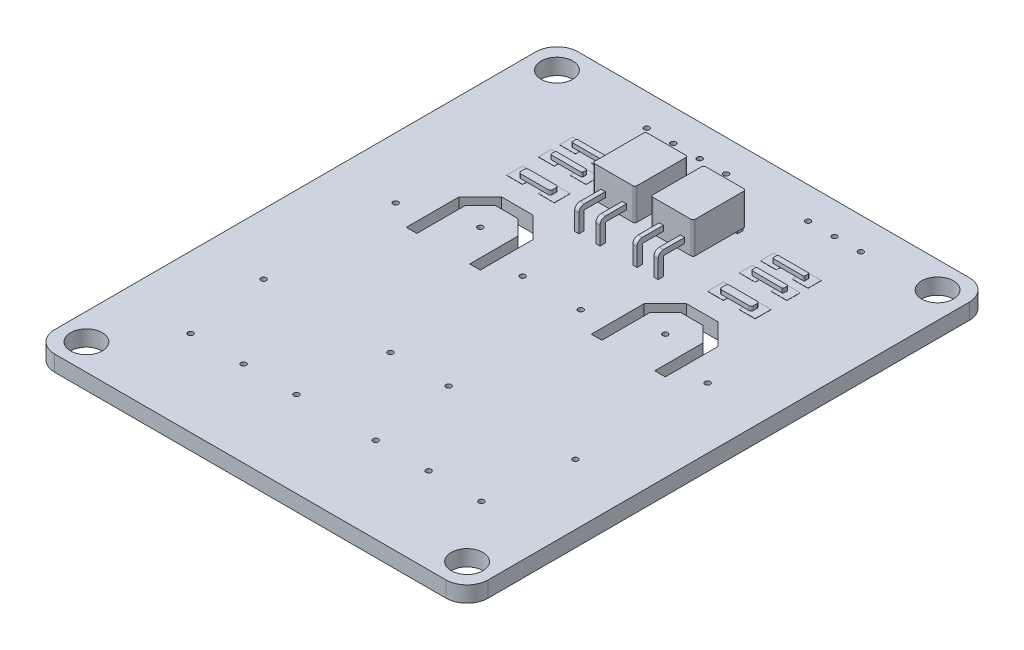
from build123d import *

# Parameters (mm, degrees)
IZIM1_R                          = 1.5
IZIM1_R_2                        = 0.25
Y_KSEKLIK_EKSTR_ZYON1_DEPTH      = 1.5
IZIM2_W                          = 1.5
IZIM2_H                          = 1.5
IZIM2_H_2                        = 1.25
Y_KSEKLIK_EKSTR_ZYON2_DEPTH      = 0.02
Y_KSEKLIK_EKSTR_ZYON3_DEPTH      = 0.4
Y_KSEKLIK_EKSTR_ZYON4_DEPTH      = 3
Y_KSEKLIK_EKSTR_ZYON4_2_DEPTH    = 3
Y_KSEKLIK_EKSTR_ZYON5_DEPTH      = 0.2
Y_KSEKLIK_EKSTR_ZYON5_DEPTH_BACK = 0.2
Y_KSEKLIK_EKSTR_ZYON6_DEPTH      = 0.2
Y_KSEKLIK_EKSTR_ZYON6_DEPTH_BACK = 0.2
Y_KSEKLIK_EKSTR_ZYON7_DEPTH      = 0.2
Y_KSEKLIK_EKSTR_ZYON7_DEPTH_BACK = 0.2
Y_KSEKLIK_EKSTR_ZYON8_DEPTH      = 0.2
Y_KSEKLIK_EKSTR_ZYON8_DEPTH_BACK = 0.2


with BuildPart() as part:
    # Çizim1 → Yükseklik-Ekstrüzyon1 (new body)
    with BuildSketch(Plane(origin=(0, 0, 0), x_dir=(1, 0, 0), z_dir=(0, 1, 0))):
        with BuildLine():
            Line((-18.5, 24.75), (18.5, 24.75))
            ThreePointArc((18.5, 24.75), (19.914213562, 24.164213562), (20.5, 22.75))
            Line((20.5, 22.75), (20.5, -22.75))
            ThreePointArc((20.5, -22.75), (19.914213562, -24.164213562), (18.5, -24.75))
            Line((18.5, -24.75), (-18.5, -24.75))
            ThreePointArc((-18.5, -24.75), (-19.914213562, -24.164213562), (-20.5, -22.75))
            Line((-20.5, -22.75), (-20.5, 22.75))
            ThreePointArc((-20.5, 22.75), (-19.914213562, 24.164213562), (-18.5, 24.75))
        make_face()
        with Locations(Location((-18, 22.25, 0), (0, 0, 270))):
            Circle(IZIM1_R, mode=Mode.SUBTRACT)
        with Locations(Location((18, 22.25, 0), (0, 0, 90))):
            Circle(IZIM1_R, mode=Mode.SUBTRACT)
        with Locations(Location((18, -22.25, 0), (0, 0, 270))):
            Circle(IZIM1_R, mode=Mode.SUBTRACT)
        with Locations(Location((-18, -22.25, 0), (0, 0, 90))):
            Circle(IZIM1_R, mode=Mode.SUBTRACT)
        with Locations(Location((-14.75, -8.75, 0), (0, 0, 270))):
            Circle(IZIM1_R_2, mode=Mode.SUBTRACT)
        with Locations(Location((-2.75, -8.75, 0), (0, 0, 270))):
            Circle(IZIM1_R_2, mode=Mode.SUBTRACT)
        with Locations(Location((-14.75, 3.75, 0), (0, 0, 270))):
            Circle(IZIM1_R_2, mode=Mode.SUBTRACT)
        with Locations(Location((-8.75, 5.75, 0), (0, 0, 270))):
            Circle(IZIM1_R_2, mode=Mode.SUBTRACT)
        with Locations(Location((-2.75, 3.75, 0), (0, 0, 270))):
            Circle(IZIM1_R_2, mode=Mode.SUBTRACT)
        with Locations(Location((14.75, 3.75, 0), (0, 0, 90))):
            Circle(IZIM1_R_2, mode=Mode.SUBTRACT)
        with Locations(Location((8.75, 5.75, 0), (0, 0, 90))):
            Circle(IZIM1_R_2, mode=Mode.SUBTRACT)
        with Locations(Location((2.75, 3.75, 0), (0, 0, 90))):
            Circle(IZIM1_R_2, mode=Mode.SUBTRACT)
        with Locations(Location((2.75, -8.75, 0), (0, 0, 90))):
            Circle(IZIM1_R_2, mode=Mode.SUBTRACT)
        with Locations(Location((14.75, -8.75, 0), (0, 0, 90))):
            Circle(IZIM1_R_2, mode=Mode.SUBTRACT)
        with Locations(Location((-8.75, -16.64, 0), (0, 0, 270))):
            Circle(IZIM1_R_2, mode=Mode.SUBTRACT)
        with Locations(Location((-3.75, -16.64, 0), (0, 0, 270))):
            Circle(IZIM1_R_2, mode=Mode.SUBTRACT)
        with Locations(Location((-13.75, -16.64, 0), (0, 0, 270))):
            Circle(IZIM1_R_2, mode=Mode.SUBTRACT)
        with Locations(Location((3.75, -16.64, 0), (0, 0, 90))):
            Circle(IZIM1_R_2, mode=Mode.SUBTRACT)
        with Locations(Location((8.75, -16.64, 0), (0, 0, 90))):
            Circle(IZIM1_R_2, mode=Mode.SUBTRACT)
        with Locations(Location((13.75, -16.64, 0), (0, 0, 90))):
            Circle(IZIM1_R_2, mode=Mode.SUBTRACT)
        with Locations(Location((-1.5, 21.75, 0), (0, 0, 270))):
            Circle(IZIM1_R_2, mode=Mode.SUBTRACT)
        with Locations(Location((-4, 21.75, 0), (0, 0, 270))):
            Circle(IZIM1_R_2, mode=Mode.SUBTRACT)
        with Locations(Location((-6.5, 21.75, 0), (0, 0, 270))):
            Circle(IZIM1_R_2, mode=Mode.SUBTRACT)
        with Locations(Location((-9, 21.75, 0), (0, 0, 270))):
            Circle(IZIM1_R_2, mode=Mode.SUBTRACT)
        with Locations(Location((8.75, 21.75, 0), (0, 0, 270))):
            Circle(IZIM1_R_2, mode=Mode.SUBTRACT)
        with Locations(Location((11.25, 21.75, 0), (0, 0, 270))):
            Circle(IZIM1_R_2, mode=Mode.SUBTRACT)
        with Locations(Location((6.25, 21.75, 0), (0, 0, 270))):
            Circle(IZIM1_R_2, mode=Mode.SUBTRACT)
        Polygon((-12.25, 7.25), (-10.25, 9.25), (-7.25, 9.25), (-5.25, 7.25), (-5.25, 2.25), (-6.25, 2.25), (-6.25, 6.835786438), (-7.664213562, 8.25), (-9.835786438, 8.25), (-11.25, 6.835786438), (-11.25, 2.25), (-12.25, 2.25), align=None, mode=Mode.SUBTRACT)
        Polygon((6.25, 2.25), (5.25, 2.25), (5.25, 7.25), (7.25, 9.25), (10.25, 9.25), (12.25, 7.25), (12.25, 2.25), (11.25, 2.25), (11.25, 6.835786438), (9.835786438, 8.25), (7.664213562, 8.25), (6.25, 6.835786438), align=None, mode=Mode.SUBTRACT)
    extrude(amount=Y_KSEKLIK_EKSTR_ZYON1_DEPTH)

    # Çizim2 → Yükseklik-Ekstrüzyon2 (add)
    with BuildSketch(Plane(origin=(0, 1.5, 0), x_dir=(1, 0, 0), z_dir=(0, 1, 0))):
        with Locations((8, 12)):
            Rectangle(IZIM2_W, IZIM2_H)
        with Locations((-8, 12)):
            Rectangle(IZIM2_W, IZIM2_H)
        with Locations((-11, 12)):
            Rectangle(IZIM2_W, IZIM2_H)
        with Locations((-8, 14.875)):
            Rectangle(IZIM2_W, IZIM2_H_2)
        with Locations((-11, 14.875)):
            Rectangle(IZIM2_W, IZIM2_H_2)
        with Locations((-8, 16.875)):
            Rectangle(IZIM2_W, IZIM2_H_2)
        with Locations((-11, 16.875)):
            Rectangle(IZIM2_W, IZIM2_H_2)
        with Locations((11, 12)):
            Rectangle(IZIM2_W, IZIM2_H)
        with Locations((8, 14.875)):
            Rectangle(IZIM2_W, IZIM2_H_2)
        with Locations((11, 14.875)):
            Rectangle(IZIM2_W, IZIM2_H_2)
        with Locations((8, 16.875)):
            Rectangle(IZIM2_W, IZIM2_H_2)
        with Locations((11, 16.875)):
            Rectangle(IZIM2_W, IZIM2_H_2)
    extrude(amount=Y_KSEKLIK_EKSTR_ZYON2_DEPTH)

    # Çizim3 → Yükseklik-Ekstrüzyon3 (add)
    with BuildSketch(Plane(origin=(0, 1.52, 0), x_dir=(1, 0, 0), z_dir=(0, 1, 0))):
        with BuildLine():
            Line((-10.9, 17.125), (-8.1, 17.125))
            ThreePointArc((-8.1, 17.125), (-8.029289322, 17.095710678), (-8, 17.025))
            Line((-8, 17.025), (-8, 16.725))
            ThreePointArc((-8, 16.725), (-8.029289322, 16.654289322), (-8.1, 16.625))
            Line((-8.1, 16.625), (-10.9, 16.625))
            ThreePointArc((-10.9, 16.625), (-10.970710678, 16.654289322), (-11, 16.725))
            Line((-11, 16.725), (-11, 17.025))
            ThreePointArc((-11, 17.025), (-10.970710678, 17.095710678), (-10.9, 17.125))
        make_face()
        with BuildLine():
            Line((-10.9, 15.125), (-8.1, 15.125))
            ThreePointArc((-8.1, 15.125), (-8.029289322, 15.095710678), (-8, 15.025))
            Line((-8, 15.025), (-8, 14.725))
            ThreePointArc((-8, 14.725), (-8.029289322, 14.654289322), (-8.1, 14.625))
            Line((-8.1, 14.625), (-10.9, 14.625))
            ThreePointArc((-10.9, 14.625), (-10.970710678, 14.654289322), (-11, 14.725))
            Line((-11, 14.725), (-11, 15.025))
            ThreePointArc((-11, 15.025), (-10.970710678, 15.095710678), (-10.9, 15.125))
        make_face()
        with BuildLine():
            Line((-10.8, 12.375), (-8.2, 12.375))
            ThreePointArc((-8.2, 12.375), (-8.058578644, 12.316421356), (-8, 12.175))
            Line((-8, 12.175), (-8, 11.825))
            ThreePointArc((-8, 11.825), (-8.058578644, 11.683578644), (-8.2, 11.625))
            Line((-8.2, 11.625), (-10.8, 11.625))
            ThreePointArc((-10.8, 11.625), (-10.941421356, 11.683578644), (-11, 11.825))
            Line((-11, 11.825), (-11, 12.175))
            ThreePointArc((-11, 12.175), (-10.941421356, 12.316421356), (-10.8, 12.375))
        make_face()
        with BuildLine():
            Line((10.9, 16.625), (8.1, 16.625))
            ThreePointArc((8.1, 16.625), (8.029289322, 16.654289322), (8, 16.725))
            Line((8, 16.725), (8, 17.025))
            ThreePointArc((8, 17.025), (8.029289322, 17.095710678), (8.1, 17.125))
            Line((8.1, 17.125), (10.9, 17.125))
            ThreePointArc((10.9, 17.125), (10.970710678, 17.095710678), (11, 17.025))
            Line((11, 17.025), (11, 16.725))
            ThreePointArc((11, 16.725), (10.970710678, 16.654289322), (10.9, 16.625))
        make_face()
        with BuildLine():
            Line((10.9, 14.625), (8.1, 14.625))
            ThreePointArc((8.1, 14.625), (8.029289322, 14.654289322), (8, 14.725))
            Line((8, 14.725), (8, 15.025))
            ThreePointArc((8, 15.025), (8.029289322, 15.095710678), (8.1, 15.125))
            Line((8.1, 15.125), (10.9, 15.125))
            ThreePointArc((10.9, 15.125), (10.970710678, 15.095710678), (11, 15.025))
            Line((11, 15.025), (11, 14.725))
            ThreePointArc((11, 14.725), (10.970710678, 14.654289322), (10.9, 14.625))
        make_face()
        with BuildLine():
            Line((10.8, 11.625), (8.2, 11.625))
            ThreePointArc((8.2, 11.625), (8.058578644, 11.683578644), (8, 11.825))
            Line((8, 11.825), (8, 12.175))
            ThreePointArc((8, 12.175), (8.058578644, 12.316421356), (8.2, 12.375))
            Line((8.2, 12.375), (10.8, 12.375))
            ThreePointArc((10.8, 12.375), (10.941421356, 12.316421356), (11, 12.175))
            Line((11, 12.175), (11, 11.825))
            ThreePointArc((11, 11.825), (10.941421356, 11.683578644), (10.8, 11.625))
        make_face()
    extrude(amount=Y_KSEKLIK_EKSTR_ZYON3_DEPTH)



with BuildPart() as body_2:
    # Çizim5 → Yükseklik-Ekstrüzyon4 (new body)
    with BuildSketch(Plane(origin=(0, 2.5, 0), x_dir=(1, 0, 0), z_dir=(0, 1, 0))):
        with BuildLine():
            Line((4.55, 12.375), (0.95, 12.375))
            ThreePointArc((0.95, 12.375), (0.808578644, 12.433578644), (0.75, 12.575))
            Line((0.75, 12.575), (0.75, 17.175))
            ThreePointArc((0.75, 17.175), (0.808578644, 17.316421356), (0.95, 17.375))
            Line((0.95, 17.375), (4.55, 17.375))
            ThreePointArc((4.55, 17.375), (4.691421356, 17.316421356), (4.75, 17.175))
            Line((4.75, 17.175), (4.75, 12.575))
            ThreePointArc((4.75, 12.575), (4.691421356, 12.433578644), (4.55, 12.375))
        make_face()
    extrude(amount=Y_KSEKLIK_EKSTR_ZYON4_DEPTH)


with BuildPart() as body_3:
    # Çizim5 → Y_kseklik-Ekstr_zyon4 2 (new body)
    with BuildSketch(Plane(origin=(0, 2.5, 0), x_dir=(1, 0, 0), z_dir=(0, 1, 0))):
        with BuildLine():
            Line((-4.55, 17.375), (-0.95, 17.375))
            ThreePointArc((-0.95, 17.375), (-0.808578644, 17.316421356), (-0.75, 17.175))
            Line((-0.75, 17.175), (-0.75, 12.575))
            ThreePointArc((-0.75, 12.575), (-0.808578644, 12.433578644), (-0.95, 12.375))
            Line((-0.95, 12.375), (-4.55, 12.375))
            ThreePointArc((-4.55, 12.375), (-4.691421356, 12.433578644), (-4.75, 12.575))
            Line((-4.75, 12.575), (-4.75, 17.175))
            ThreePointArc((-4.75, 17.175), (-4.691421356, 17.316421356), (-4.55, 17.375))
        make_face()
    extrude(amount=Y_KSEKLIK_EKSTR_ZYON4_2_DEPTH)


with BuildPart() as part_1:
    add(part.part)

    add(body_3.part)  # Yükseklik-Ekstrüzyon5 merges body 3
    # Çizim8 → Yükseklik-Ekstrüzyon5 (add, two sides: drawn at the far end of the back side and taken through both)
    with BuildSketch(Plane.ZY.offset(3.75).offset(-Y_KSEKLIK_EKSTR_ZYON5_DEPTH_BACK)):
        with BuildLine():
            Line((-17.375, 3.210871737), (-10.375, 3.210871737))
            Line((-10.375, 3.210871737), (-10.375, 0.798774868))
            Line((-10.375, 0.798774868), (-9.875, 0.798774868))
            Line((-9.875, 0.798774868), (-9.875, 3.210871737))
            ThreePointArc((-9.875, 3.210871737), (-10.021446609, 3.564425128), (-10.375, 3.710871737))
            Line((-10.375, 3.710871737), (-17.375, 3.710871737))
            ThreePointArc((-17.375, 3.710871737), (-17.728553391, 3.564425128), (-17.875, 3.210871737))
            Line((-17.875, 3.210871737), (-17.875, 0.798774868))
            Line((-17.875, 0.798774868), (-17.375, 0.798774868))
            Line((-17.375, 0.798774868), (-17.375, 3.210871737))
        make_face()
    extrude(amount=Y_KSEKLIK_EKSTR_ZYON5_DEPTH + Y_KSEKLIK_EKSTR_ZYON5_DEPTH_BACK)

    # Çizim9 → Yükseklik-Ekstrüzyon6 (add, two sides: drawn at the far end of the back side and taken through both)
    with BuildSketch(Plane(origin=(-1.75, 0, 0), x_dir=(0, 0, -1), z_dir=(1, 0, 0)).offset(-Y_KSEKLIK_EKSTR_ZYON6_DEPTH_BACK)):
        with BuildLine():
            Line((10.378377538, 0.559357084), (10.378377538, 3.210871737))
            Line((10.378377538, 3.210871737), (17.371622462, 3.210871737))
            Line((17.371622462, 3.210871737), (17.371622462, 0.559357084))
            Line((17.371622462, 0.559357084), (17.871622462, 0.559357084))
            Line((17.871622462, 0.559357084), (17.871622462, 3.210871737))
            ThreePointArc((17.871622462, 3.210871737), (17.725175853, 3.564425128), (17.371622462, 3.710871737))
            Line((17.371622462, 3.710871737), (10.378377538, 3.710871737))
            ThreePointArc((10.378377538, 3.710871737), (10.024824147, 3.564425128), (9.878377538, 3.210871737))
            Line((9.878377538, 3.210871737), (9.878377538, 0.559357084))
            Line((9.878377538, 0.559357084), (10.378377538, 0.559357084))
        make_face()
    extrude(amount=Y_KSEKLIK_EKSTR_ZYON6_DEPTH + Y_KSEKLIK_EKSTR_ZYON6_DEPTH_BACK)


    add(body_2.part)  # Yükseklik-Ekstrüzyon7 merges body 2
    # Çizim10 → Yükseklik-Ekstrüzyon7 (add, two sides: drawn at the far end of the back side and taken through both)
    with BuildSketch(Plane(origin=(3.75, 0, 0), x_dir=(0, 0, -1), z_dir=(1, 0, 0)).offset(-Y_KSEKLIK_EKSTR_ZYON7_DEPTH_BACK)):
        with BuildLine():
            Line((10.375, 0.625240508), (10.375, 3.2127649))
            Line((10.375, 3.2127649), (17.375, 3.2127649))
            Line((17.375, 3.2127649), (17.375, 0.625240508))
            Line((17.375, 0.625240508), (17.875, 0.625240508))
            Line((17.875, 0.625240508), (17.875, 3.2127649))
            ThreePointArc((17.875, 3.2127649), (17.728553391, 3.56631829), (17.375, 3.7127649))
            Line((17.375, 3.7127649), (10.375, 3.7127649))
            ThreePointArc((10.375, 3.7127649), (10.021446609, 3.56631829), (9.875, 3.2127649))
            Line((9.875, 3.2127649), (9.875, 0.625240508))
            Line((9.875, 0.625240508), (10.375, 0.625240508))
        make_face()
    extrude(amount=Y_KSEKLIK_EKSTR_ZYON7_DEPTH + Y_KSEKLIK_EKSTR_ZYON7_DEPTH_BACK)

    # Çizim11 → Yükseklik-Ekstrüzyon8 (add, two sides: drawn at the far end of the back side and taken through both)
    with BuildSketch(Plane.ZY.offset(-1.75).offset(-Y_KSEKLIK_EKSTR_ZYON8_DEPTH_BACK)):
        with BuildLine():
            Line((-17.375, 0.555982075), (-17.375, 3.210871737))
            Line((-17.375, 3.210871737), (-10.375, 3.210871737))
            Line((-10.375, 3.210871737), (-10.375, 0.555982075))
            Line((-10.375, 0.555982075), (-9.875, 0.555982075))
            Line((-9.875, 0.555982075), (-9.875, 3.210871737))
            ThreePointArc((-9.875, 3.210871737), (-10.021446609, 3.564425128), (-10.375, 3.710871737))
            Line((-10.375, 3.710871737), (-17.375, 3.710871737))
            ThreePointArc((-17.375, 3.710871737), (-17.728553391, 3.564425128), (-17.875, 3.210871737))
            Line((-17.875, 3.210871737), (-17.875, 0.555982075))
            Line((-17.875, 0.555982075), (-17.375, 0.555982075))
        make_face()
    extrude(amount=Y_KSEKLIK_EKSTR_ZYON8_DEPTH + Y_KSEKLIK_EKSTR_ZYON8_DEPTH_BACK)


solid = part_1.part
